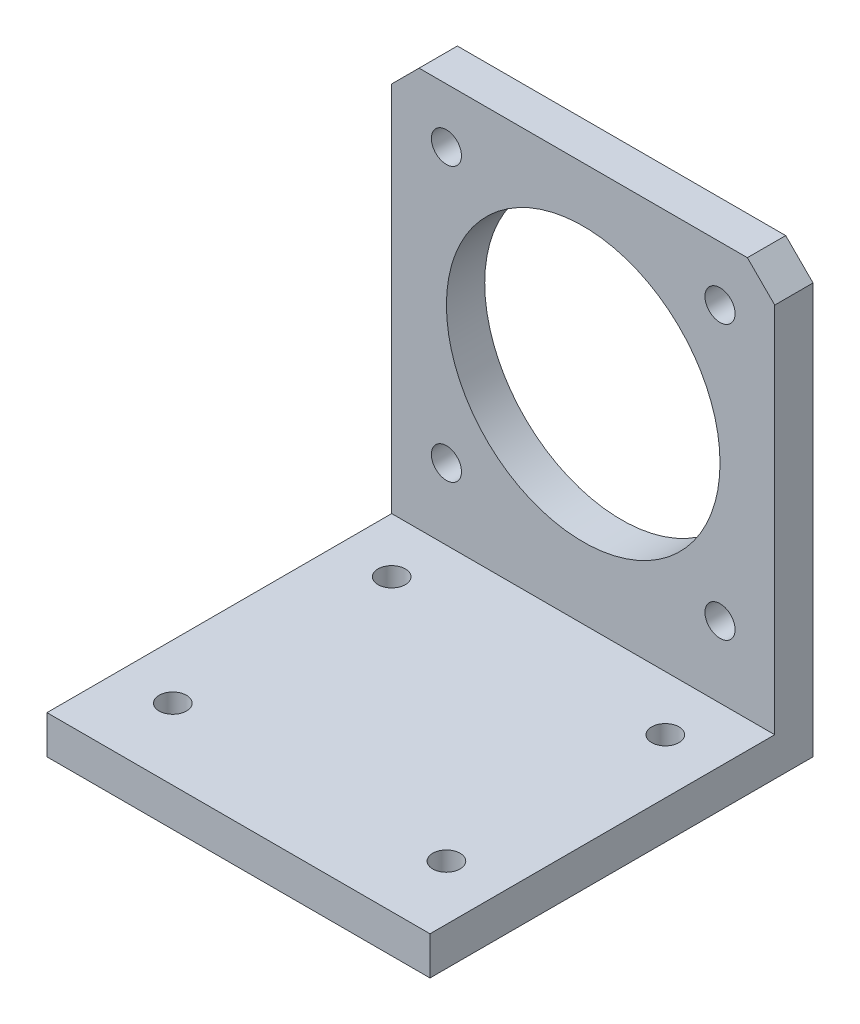
from build123d import *

# Parameters (mm, degrees)
SKETCH1_W           = 70
SKETCH1_H           = 80
SKETCH1_R           = 2.75
SKETCH1_R_2         = 25
BOSS_EXTRUDE1_DEPTH = 7
SKETCH2_W           = 70
SKETCH2_H           = 70
BOSS_EXTRUDE2_DEPTH = 7
SKETCH3_R           = 2.5
CUT_EXTRUDE1_DEPTH  = 7
CHAMFER1_SIZE       = 5


with BuildPart() as part:
    # Sketch1 → Boss-Extrude1 (new body)
    with BuildSketch(Plane.XY):
        Rectangle(SKETCH1_W, SKETCH1_H)
        with Locations((-25, 30)):
            Circle(SKETCH1_R, mode=Mode.SUBTRACT)
        with Locations((25, 30)):
            Circle(SKETCH1_R, mode=Mode.SUBTRACT)
        with Locations((-25, -20)):
            Circle(SKETCH1_R, mode=Mode.SUBTRACT)
        with Locations((25, -20)):
            Circle(SKETCH1_R, mode=Mode.SUBTRACT)
        with Locations((0, 5)):
            Circle(SKETCH1_R_2, mode=Mode.SUBTRACT)
    extrude(amount=BOSS_EXTRUDE1_DEPTH)

    # Sketch2 → Boss-Extrude2 (add)
    with BuildSketch(Plane.XZ.offset(40)):
        with Locations((0, 35)):
            Rectangle(SKETCH2_W, SKETCH2_H)
    extrude(amount=-BOSS_EXTRUDE2_DEPTH)

    # Sketch3 → Cut-Extrude1 (cut)
    with BuildSketch(Plane(origin=(0, -33, 0), x_dir=(1, 0, 0), z_dir=(0, 1, 0))):
        with Locations(Location((-25, -17, 0), (0, 0, 270))):
            Circle(SKETCH3_R)
        with Locations(Location((25, -17, 0), (0, 0, 270))):
            Circle(SKETCH3_R)
        with Locations(Location((-25, -57, 0), (0, 0, 270))):
            Circle(SKETCH3_R)
        with Locations(Location((25, -57, 0), (0, 0, 270))):
            Circle(SKETCH3_R)
    extrude(amount=-CUT_EXTRUDE1_DEPTH, mode=Mode.SUBTRACT)

    # Chamfer1
    chamfer1_edges = [part.edges().sort_by_distance(p)[0] for p in [
        (-35, 40, 3.5),
        (35, 40, 3.5),
    ]]
    chamfer(chamfer1_edges, length=CHAMFER1_SIZE)


solid = part.part
